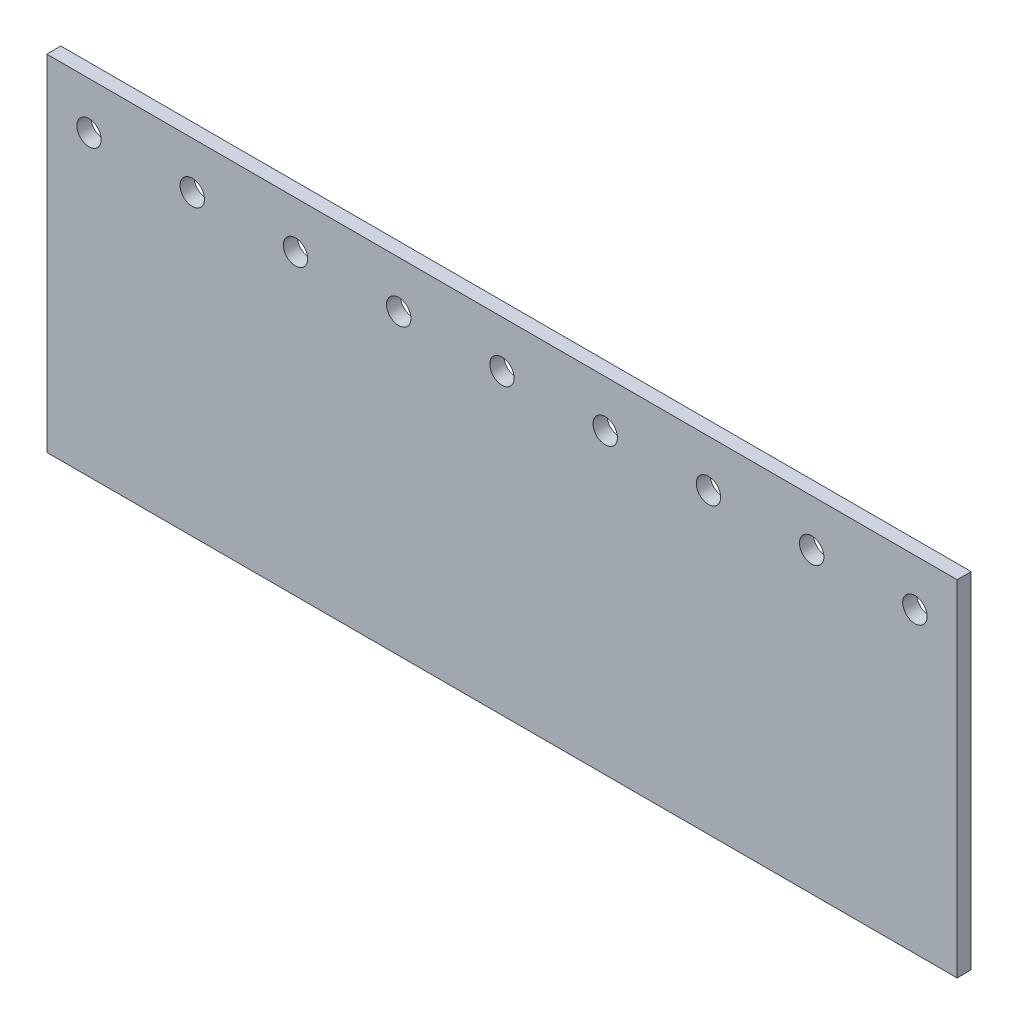
from build123d import *

# Parameters (mm, degrees)
SKETCH_1_W                 = 200
SKETCH_1_H                 = 73.5
EXTRUDE_1_DEPTH            = 3
SKETCH_2_R                 = 2.6
CUT_EXTRUDE_2_DEPTH        = 107.581248351
PATTERN_LINEAR_1_COUNT     = 5
PATTERN_LINEAR_1_PITCH     = 22
PATTERN_LINEAR_1_COL_COUNT = 5
PATTERN_LINEAR_1_COL_PITCH = 22
CUT_EXTRUDE_3_DEPTH        = 107.581248351
CUT_EXTRUDE_3_DEPTH_BACK   = 107.581248351
SKETCH_3_W                 = 3
SKETCH_3_H                 = 73.5


with BuildPart() as part:
    # 草图1 → 凸台-拉伸1 (new body)
    with BuildSketch(Plane.XY):
        Rectangle(SKETCH_1_W, SKETCH_1_H)
    extrude(amount=EXTRUDE_1_DEPTH)

    # 草图2 → 切除-拉伸2 (cut, symmetric)
    with BuildSketch(Plane.XY.offset(3)):
        with Locations((0, 26.75)):
            Circle(SKETCH_2_R)
    cut_extrude_2 = extrude(amount=CUT_EXTRUDE_2_DEPTH, both=True, mode=Mode.SUBTRACT)

    # 阵列(线性)1: 切除-拉伸2 ×5
    with Locations(*[(i * PATTERN_LINEAR_1_PITCH, 0, 0) for i in range(1, PATTERN_LINEAR_1_COUNT)]):
        add(cut_extrude_2, mode=Mode.SUBTRACT)

    # 阵列(线性)1 col: 切除-拉伸2 ×5
    with Locations(*[(-i * PATTERN_LINEAR_1_COL_PITCH, 0, 0) for i in range(1, PATTERN_LINEAR_1_COL_COUNT)]):
        add(cut_extrude_2, mode=Mode.SUBTRACT)

    # 草图3 → 切除-拉伸3 (cut, two sides: drawn at the far end of the back side and taken through both)
    with BuildSketch(Plane.XY.offset(3).offset(-CUT_EXTRUDE_3_DEPTH_BACK)):
        with Locations((-98.5, 0)):
            Rectangle(SKETCH_3_W, SKETCH_3_H)
        with Locations((98.5, 0)):
            Rectangle(SKETCH_3_W, SKETCH_3_H)
    extrude(amount=CUT_EXTRUDE_3_DEPTH + CUT_EXTRUDE_3_DEPTH_BACK, mode=Mode.SUBTRACT)


solid = part.part
